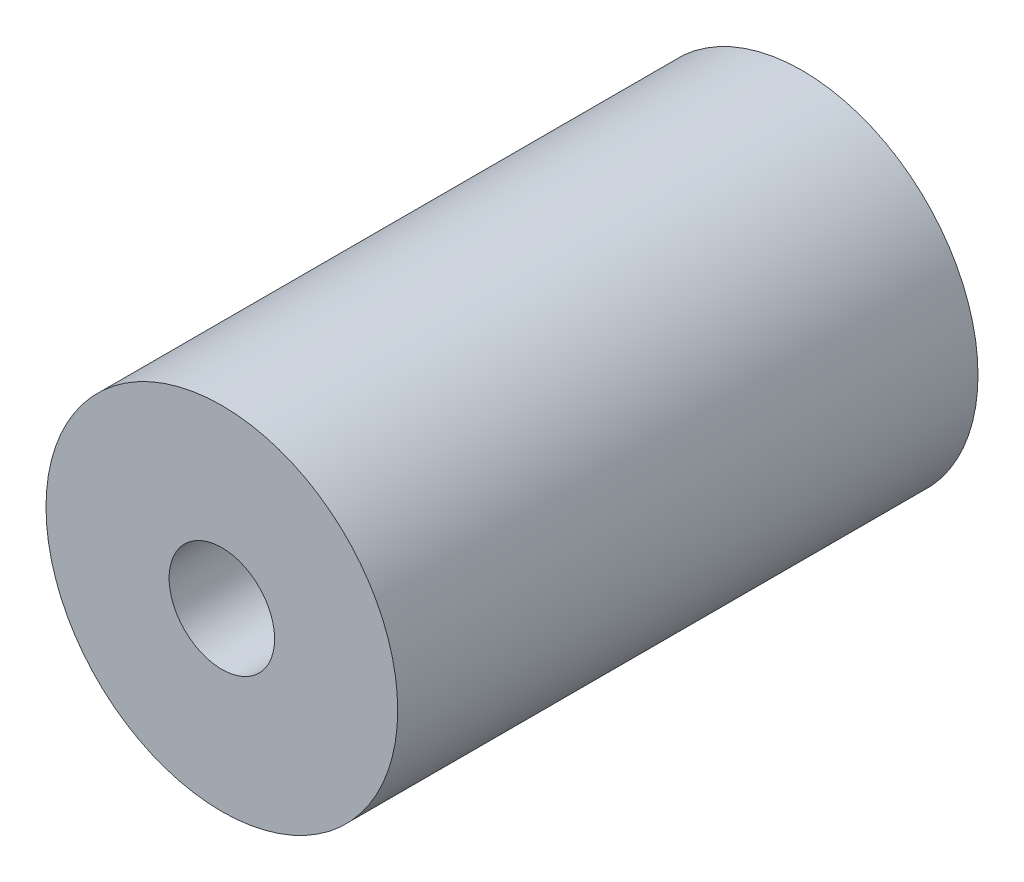
from build123d import *

# Parameters (mm, degrees)
SKETCH1_R           = 10
BOSS_EXTRUDE1_DEPTH = 33
SKETCH2_R           = 5
CUT_EXTRUDE1_DEPTH  = 12
SKETCH3_R           = 3
CUT_EXTRUDE2_DEPTH  = 13


with BuildPart() as part:
    # Sketch1 → Boss-Extrude1 (new body)
    with BuildSketch(Plane.XY):
        Circle(SKETCH1_R)
    extrude(amount=BOSS_EXTRUDE1_DEPTH)

    # Sketch2 → Cut-Extrude1 (cut)
    with BuildSketch(Plane(origin=(0, 0, 0), x_dir=(-1, 0, 0), z_dir=(0, 0, -1))):
        Circle(SKETCH2_R)
    extrude(amount=-CUT_EXTRUDE1_DEPTH, mode=Mode.SUBTRACT)

    # Sketch3 → Cut-Extrude2 (cut)
    with BuildSketch(Plane.XY.offset(33)):
        Circle(SKETCH3_R)
    extrude(amount=-CUT_EXTRUDE2_DEPTH, mode=Mode.SUBTRACT)


solid = part.part
